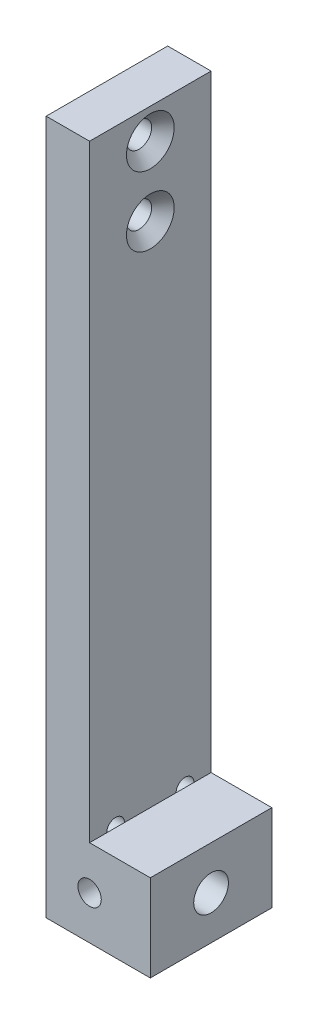
from build123d import *

# Parameters (mm, degrees)
SKETCH_1_W                      = 14
SKETCH_1_H                      = 80
EXTRUDE_1_DEPTH                 = 5
SKETCH_14_W                     = 14
SKETCH_14_H                     = 10
EXTRUDE_2_DEPTH                 = 7
HOLE_WIZARD_M2_5_1_D            = 2.9
HOLE_WIZARD_M2_5_1_CSINK_D      = 5.5
HOLE_WIZARD_M2_5_1_CSINK_ANGLE  = 90
SKETCH_9_W                      = 1.025
SKETCH_9_H                      = 5
HOLE_WIZARD_M2_5_1_2_AT_2_COUNT = 2
HOLE_WIZARD_M2_5_1_2_AT_2_PITCH = 8
SKETCH_15_R                     = 2
CUT_EXTRUDE_2_DEPTH             = 43.343830719
F_1_0MM_2_REACH                 = 46.045
F_1_0MM_2_BORE_R                = 1.35
F_1_0MM_1_REACH                 = 83.197
F_1_0MM_1_BORE_R                = 1.35


with BuildPart() as part:
    # 草圖1 → 填料-伸長1 (new body)
    with BuildSketch(Plane(origin=(0, 0, 0), x_dir=(0, 0, -1), z_dir=(1, 0, 0))):
        Rectangle(SKETCH_1_W, SKETCH_1_H)
    extrude(amount=EXTRUDE_1_DEPTH)

    # 草圖14 → 填料-伸長2 (add)
    with BuildSketch(Plane(origin=(5, 0, 0), x_dir=(0, 0, -1), z_dir=(1, 0, 0))):
        with Locations((0, -35)):
            Rectangle(SKETCH_14_W, SKETCH_14_H)
    extrude(amount=EXTRUDE_2_DEPTH)

    # Hole Wizard M2.5 _1 (through all)
    with Locations(Plane(origin=(5, 0, 0), x_dir=(0, 0, -1), z_dir=(1, 0, 0))):
        with Locations((0, 36.5), (0, 28.5)):
            CounterSinkHole(HOLE_WIZARD_M2_5_1_D / 2, HOLE_WIZARD_M2_5_1_CSINK_D / 2, counter_sink_angle=HOLE_WIZARD_M2_5_1_CSINK_ANGLE)

    # 草圖9 → Hole Wizard M2.5 _1 2 (revolve, cut)
    with BuildSketch(Plane(origin=(5, -30, -4), x_dir=(0, 0, -1), z_dir=(0, 1, 0))):
        with Locations((0.5125, 2.5)):
            Rectangle(SKETCH_9_W, SKETCH_9_H)
    hole_wizard_m2_5_1_2 = revolve(axis=Axis((11.35, -30, -4), (-1, 0, 0)), mode=Mode.SUBTRACT)

    # Hole Wizard M2.5 _1 2 at 2: Hole Wizard M2.5 _1 2 ×2
    with Locations(*[(0, 0, i * HOLE_WIZARD_M2_5_1_2_AT_2_PITCH) for i in range(1, HOLE_WIZARD_M2_5_1_2_AT_2_COUNT)]):
        add(hole_wizard_m2_5_1_2, mode=Mode.SUBTRACT)

    # 草圖15 → 除料-伸長2 (cut, through all)
    with BuildSketch(Plane.ZY):
        with Locations((0, -35)):
            Circle(SKETCH_15_R)
    extrude(amount=-CUT_EXTRUDE_2_DEPTH, mode=Mode.SUBTRACT)

    # Ø1.0mm 定位孔2 bore → Ø1.0mm 定位孔2 (cut, up to next)
    with BuildSketch(Plane(origin=(0, 0, -7), x_dir=(-1, 0, 0), z_dir=(0, 0, -1)), mode=Mode.PRIVATE) as f_1_0mm_2_sk1:
        with Locations((-5, -35)):
            Circle(F_1_0MM_2_BORE_R)
    f_1_0mm_2_tool1 = extrude(f_1_0mm_2_sk1.sketch, amount=-F_1_0MM_2_REACH, mode=Mode.PRIVATE) & part.part
    f_1_0mm_2 = f_1_0mm_2_tool1.solids().sort_by_distance((5, -35, -7))[0]
    add(f_1_0mm_2, mode=Mode.SUBTRACT)

    # 鏡射2: Ø1.0mm 定位孔2 across plane
    add(f_1_0mm_2.mirror(Plane.XY), mode=Mode.SUBTRACT)

    # Ø1.0mm 定位孔1 bore → Ø1.0mm 定位孔1 (cut, up to next)
    with BuildSketch(Plane(origin=(0, -40, 0), x_dir=(-1, 0, 0), z_dir=(0, -1, 0)), mode=Mode.PRIVATE) as f_1_0mm_1_sk1:
        with Locations((-8, 0)):
            Circle(F_1_0MM_1_BORE_R)
    f_1_0mm_1_tool1 = extrude(f_1_0mm_1_sk1.sketch, amount=-F_1_0MM_1_REACH, mode=Mode.PRIVATE) & part.part
    add(f_1_0mm_1_tool1.solids().sort_by_distance((8, -40, 0))[0], mode=Mode.SUBTRACT)


solid = part.part
